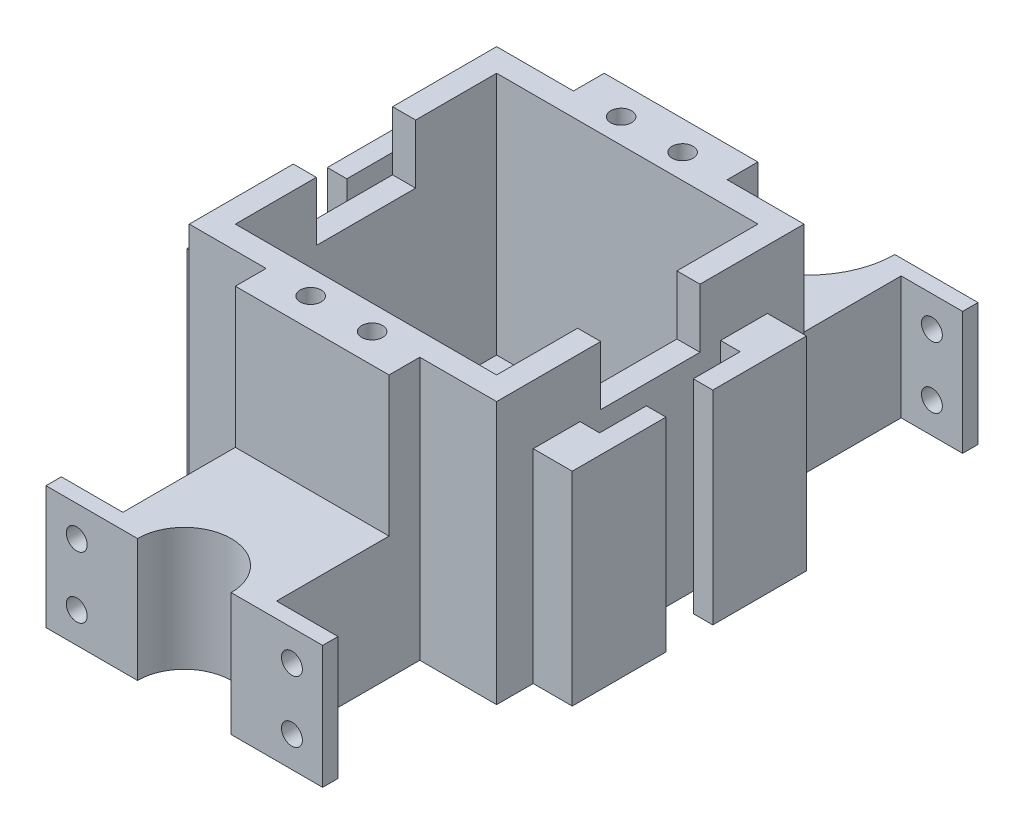
from build123d import *

# Parameters (mm, degrees)
SKETCH1_W                                    = 50
SKETCH1_H                                    = 50
BOSS_EXTRUDE1_DEPTH                          = 3
SKETCH3_W                                    = 50
SKETCH3_H                                    = 50
SKETCH3_W_2                                  = 42.5
SKETCH3_H_2                                  = 42.5
BOSS_EXTRUDE2_DEPTH                          = 39.7
SKETCH9_W                                    = 25
SKETCH9_H                                    = 20
BOSS_EXTRUDE4_DEPTH                          = 25.8
CUT_EXTRUDE1_REACH                           = 62.999
SKETCH11_R                                   = 7.62
SKETCH12_W                                   = 2.5
SKETCH12_H                                   = 20
BOSS_EXTRUDE5_DEPTH                          = 10
CUT_EXTRUDE2_REACH                           = 92.52
SKETCH13_R                                   = 1.7
SKETCH15_W                                   = 35
SKETCH15_H                                   = 20
BOSS_EXTRUDE6_DEPTH                          = 25.8
CUT_EXTRUDE3_REACH                           = 62.999
SKETCH16_R                                   = 13.97
SKETCH17_W                                   = 2.5
SKETCH17_H                                   = 20
BOSS_EXTRUDE7_DEPTH                          = 10
CUT_EXTRUDE4_REACH                           = 115.587
SKETCH18_R                                   = 1.7
CUT_EXTRUDE5_START                           = -5
SKETCH19_W                                   = 16.15
SKETCH19_H                                   = 9.6
CUT_EXTRUDE5_DEPTH                           = 90.617846817
SKETCH20_W                                   = 25
SKETCH20_H                                   = 5
BOSS_EXTRUDE8_DEPTH                          = 22.7
SKETCH21_R                                   = 1.7
CUT_EXTRUDE6_DEPTH                           = 10
SKETCH23_W                                   = 7.62
SKETCH23_H                                   = 33.09
BOSS_EXTRUDE9_DEPTH                          = 6.35
SKETCH24_W                                   = 3.175
SKETCH24_H                                   = 33.09
BOSS_EXTRUDE10_DEPTH                         = 7.62
SKETCH25_W                                   = 3.175
SKETCH25_H                                   = 33.09
BOSS_EXTRUDE11_DEPTH                         = 7.62
CUT_EXTRUDE8_REACH                           = 75.394
SKETCH27_R                                   = 11.5
CSK_FOR_M3_COUNTERSUNK_FLAT_HEAD_SCR_2_COUNT = 2
CSK_FOR_M3_COUNTERSUNK_FLAT_HEAD_SCR_2_PITCH = 31
CSK_FOR_M3_COUNTERSUNK_FLAT_HEAD_SCR_3_COUNT = 2
CSK_FOR_M3_COUNTERSUNK_FLAT_HEAD_SCR_3_PITCH = 43.840620434
CSK_FOR_M3_COUNTERSUNK_FLAT_HEAD_SCR_4_COUNT = 2
CSK_FOR_M3_COUNTERSUNK_FLAT_HEAD_SCR_4_PITCH = 31


with BuildPart() as part:
    # Sketch1 → Boss-Extrude1 (new body)
    with BuildSketch(Plane(origin=(0, 0, 0), x_dir=(1, 0, 0), z_dir=(0, 1, 0))):
        Rectangle(SKETCH1_W, SKETCH1_H)
    extrude(amount=BOSS_EXTRUDE1_DEPTH)

    # Sketch3 → Boss-Extrude2 (add)
    with BuildSketch(Plane(origin=(0, 3, 0), x_dir=(1, 0, 0), z_dir=(0, 1, 0))):
        Rectangle(SKETCH3_W, SKETCH3_H)
        Rectangle(SKETCH3_W_2, SKETCH3_H_2, mode=Mode.SUBTRACT)
    extrude(amount=BOSS_EXTRUDE2_DEPTH)

    # Sketch9 → Boss-Extrude4 (add)
    with BuildSketch(Plane.XY.offset(25)):
        with Locations((0, 10)):
            Rectangle(SKETCH9_W, SKETCH9_H)
    extrude(amount=BOSS_EXTRUDE4_DEPTH)

    # Sketch11 → Cut-Extrude1 (cut, up to next)
    with BuildSketch(Plane(origin=(0, 20, 0), x_dir=(1, 0, 0), z_dir=(0, 1, 0)), mode=Mode.PRIVATE) as cut_extrude1_sk1:
        with Locations((0, -50.8)):
            Circle(SKETCH11_R)
    cut_extrude1_tool1 = extrude(cut_extrude1_sk1.sketch, amount=-CUT_EXTRUDE1_REACH, mode=Mode.PRIVATE) & part.part
    add(cut_extrude1_tool1.solids().sort_by_distance((0, 20, 50.8))[0], mode=Mode.SUBTRACT)

    # Sketch12 → Boss-Extrude5 (add)
    with BuildSketch(Plane.ZY.offset(12.5)):
        with Locations((49.55, 10)):
            Rectangle(SKETCH12_W, SKETCH12_H)
    boss_extrude5 = extrude(amount=BOSS_EXTRUDE5_DEPTH)

    # Mirror2: Boss-Extrude5 across plane
    add(boss_extrude5.mirror(Plane(origin=(0, 0, 0), x_dir=(0, 0, 1), z_dir=(1, 0, 0))))

    # Sketch13 → Cut-Extrude2 (cut, up to next)
    with BuildSketch(Plane.XY.offset(50.8), mode=Mode.PRIVATE) as cut_extrude2_sk1:
        with Locations((-17.5, 5)):
            Circle(SKETCH13_R)
    cut_extrude2_tool1 = extrude(cut_extrude2_sk1.sketch, amount=-CUT_EXTRUDE2_REACH, mode=Mode.PRIVATE) & part.part
    # Sketch13 → Cut-Extrude2 (cut, up to next)
    with BuildSketch(Plane.XY.offset(50.8), mode=Mode.PRIVATE) as cut_extrude2_sk2:
        with Locations((17.5, 5)):
            Circle(SKETCH13_R)
    cut_extrude2_tool2 = extrude(cut_extrude2_sk2.sketch, amount=-CUT_EXTRUDE2_REACH, mode=Mode.PRIVATE) & part.part
    # Sketch13 → Cut-Extrude2 (cut, up to next)
    with BuildSketch(Plane.XY.offset(50.8), mode=Mode.PRIVATE) as cut_extrude2_sk3:
        with Locations((-17.5, 15)):
            Circle(SKETCH13_R)
    cut_extrude2_tool3 = extrude(cut_extrude2_sk3.sketch, amount=-CUT_EXTRUDE2_REACH, mode=Mode.PRIVATE) & part.part
    # Sketch13 → Cut-Extrude2 (cut, up to next)
    with BuildSketch(Plane.XY.offset(50.8), mode=Mode.PRIVATE) as cut_extrude2_sk4:
        with Locations((17.5, 15)):
            Circle(SKETCH13_R)
    cut_extrude2_tool4 = extrude(cut_extrude2_sk4.sketch, amount=-CUT_EXTRUDE2_REACH, mode=Mode.PRIVATE) & part.part
    add(cut_extrude2_tool1.solids().sort_by_distance((-17.5, 5, 50.8))[0], mode=Mode.SUBTRACT)
    add(cut_extrude2_tool2.solids().sort_by_distance((17.5, 5, 50.8))[0], mode=Mode.SUBTRACT)
    add(cut_extrude2_tool3.solids().sort_by_distance((-17.5, 15, 50.8))[0], mode=Mode.SUBTRACT)
    add(cut_extrude2_tool4.solids().sort_by_distance((17.5, 15, 50.8))[0], mode=Mode.SUBTRACT)

    # Sketch15 → Boss-Extrude6 (add)
    with BuildSketch(Plane(origin=(0, 0, -25), x_dir=(-1, 0, 0), z_dir=(0, 0, -1))):
        with Locations((0, 10)):
            Rectangle(SKETCH15_W, SKETCH15_H)
    extrude(amount=BOSS_EXTRUDE6_DEPTH)

    # Sketch16 → Cut-Extrude3 (cut, up to next)
    with BuildSketch(Plane(origin=(0, 20, 0), x_dir=(1, 0, 0), z_dir=(0, 1, 0)), mode=Mode.PRIVATE) as cut_extrude3_sk1:
        with Locations((0, 50.8)):
            Circle(SKETCH16_R)
    cut_extrude3_tool1 = extrude(cut_extrude3_sk1.sketch, amount=-CUT_EXTRUDE3_REACH, mode=Mode.PRIVATE) & part.part
    add(cut_extrude3_tool1.solids().sort_by_distance((0, 20, -50.8))[0], mode=Mode.SUBTRACT)

    # Sketch17 → Boss-Extrude7 (add)
    with BuildSketch(Plane.ZY.offset(17.5)):
        with Locations((-49.55, 10)):
            Rectangle(SKETCH17_W, SKETCH17_H)
    boss_extrude7 = extrude(amount=BOSS_EXTRUDE7_DEPTH)

    # Mirror3: Boss-Extrude7 across plane
    add(boss_extrude7.mirror(Plane(origin=(0, 0, 0), x_dir=(0, 0, 1), z_dir=(1, 0, 0))))

    # Sketch18 → Cut-Extrude4 (cut, up to next)
    with BuildSketch(Plane(origin=(0, 0, -50.8), x_dir=(-1, 0, 0), z_dir=(0, 0, -1)), mode=Mode.PRIVATE) as cut_extrude4_sk1:
        with Locations((-22.5, 15)):
            Circle(SKETCH18_R)
    cut_extrude4_tool1 = extrude(cut_extrude4_sk1.sketch, amount=-CUT_EXTRUDE4_REACH, mode=Mode.PRIVATE) & part.part
    # Sketch18 → Cut-Extrude4 (cut, up to next)
    with BuildSketch(Plane(origin=(0, 0, -50.8), x_dir=(-1, 0, 0), z_dir=(0, 0, -1)), mode=Mode.PRIVATE) as cut_extrude4_sk2:
        with Locations((-22.5, 5)):
            Circle(SKETCH18_R)
    cut_extrude4_tool2 = extrude(cut_extrude4_sk2.sketch, amount=-CUT_EXTRUDE4_REACH, mode=Mode.PRIVATE) & part.part
    # Sketch18 → Cut-Extrude4 (cut, up to next)
    with BuildSketch(Plane(origin=(0, 0, -50.8), x_dir=(-1, 0, 0), z_dir=(0, 0, -1)), mode=Mode.PRIVATE) as cut_extrude4_sk3:
        with Locations((22.5, 15)):
            Circle(SKETCH18_R)
    cut_extrude4_tool3 = extrude(cut_extrude4_sk3.sketch, amount=-CUT_EXTRUDE4_REACH, mode=Mode.PRIVATE) & part.part
    # Sketch18 → Cut-Extrude4 (cut, up to next)
    with BuildSketch(Plane(origin=(0, 0, -50.8), x_dir=(-1, 0, 0), z_dir=(0, 0, -1)), mode=Mode.PRIVATE) as cut_extrude4_sk4:
        with Locations((22.5, 5)):
            Circle(SKETCH18_R)
    cut_extrude4_tool4 = extrude(cut_extrude4_sk4.sketch, amount=-CUT_EXTRUDE4_REACH, mode=Mode.PRIVATE) & part.part
    add(cut_extrude4_tool1.solids().sort_by_distance((22.5, 15, -50.8))[0], mode=Mode.SUBTRACT)
    add(cut_extrude4_tool2.solids().sort_by_distance((22.5, 5, -50.8))[0], mode=Mode.SUBTRACT)
    add(cut_extrude4_tool3.solids().sort_by_distance((-22.5, 15, -50.8))[0], mode=Mode.SUBTRACT)
    add(cut_extrude4_tool4.solids().sort_by_distance((-22.5, 5, -50.8))[0], mode=Mode.SUBTRACT)

    # Sketch19 → Cut-Extrude5 (cut)
    with BuildSketch(Plane(origin=(25, 0, 0), x_dir=(0, 0, -1), z_dir=(1, 0, 0)).offset(CUT_EXTRUDE5_START)):
        with Locations((0, 37.9)):
            Rectangle(SKETCH19_W, SKETCH19_H)
    cut_extrude5 = extrude(amount=CUT_EXTRUDE5_DEPTH, mode=Mode.SUBTRACT)

    # Sketch20 → Boss-Extrude8 (add)
    with BuildSketch(Plane(origin=(0, 20, 0), x_dir=(1, 0, 0), z_dir=(0, 1, 0))):
        with Locations((0, -27.5)):
            Rectangle(SKETCH20_W, SKETCH20_H)
        with Locations((0, 27.5)):
            Rectangle(SKETCH20_W, SKETCH20_H)
    extrude(amount=BOSS_EXTRUDE8_DEPTH)

    # Sketch21 → Cut-Extrude6 (cut)
    with BuildSketch(Plane(origin=(0, 42.7, 0), x_dir=(1, 0, 0), z_dir=(0, 1, 0))):
        with Locations(Location((5, -25.25, 0), (0, 0, 270))):
            Circle(SKETCH21_R)
        with Locations(Location((-5, 25.25, 0), (0, 0, 270))):
            Circle(SKETCH21_R)
        with Locations(Location((5, 25.25, 0), (0, 0, 270))):
            Circle(SKETCH21_R)
        with Locations(Location((-5, -25.25, 0), (0, 0, 270))):
            Circle(SKETCH21_R)
    extrude(amount=-CUT_EXTRUDE6_DEPTH, mode=Mode.SUBTRACT)

    # Sketch23 → Boss-Extrude9 (add)
    with BuildSketch(Plane.ZY.offset(25)):
        with Locations((-15.24, 16.545)):
            Rectangle(SKETCH23_W, SKETCH23_H)
        with Locations((15.24, 16.545)):
            Rectangle(SKETCH23_W, SKETCH23_H)
    boss_extrude9 = extrude(amount=BOSS_EXTRUDE9_DEPTH)

    # Sketch24 → Boss-Extrude10 (add)
    with BuildSketch(Plane.XY.offset(-11.43)):
        with Locations((-29.7625, 16.545)):
            Rectangle(SKETCH24_W, SKETCH24_H)
    boss_extrude10 = extrude(amount=BOSS_EXTRUDE10_DEPTH)

    # Sketch25 → Boss-Extrude11 (add)
    with BuildSketch(Plane(origin=(0, 0, 11.43), x_dir=(-1, 0, 0), z_dir=(0, 0, -1))):
        with Locations((29.7625, 16.545)):
            Rectangle(SKETCH25_W, SKETCH25_H)
    boss_extrude11 = extrude(amount=BOSS_EXTRUDE11_DEPTH)

    # Sketch27 → Cut-Extrude8 (cut, up to next)
    with BuildSketch(Plane.XZ, mode=Mode.PRIVATE) as cut_extrude8_sk1:
        with Locations(Location((0, 0, 0), (0, 0, 270))):
            Circle(SKETCH27_R)
    cut_extrude8_tool1 = extrude(cut_extrude8_sk1.sketch, amount=-CUT_EXTRUDE8_REACH, mode=Mode.PRIVATE) & part.part
    add(cut_extrude8_tool1.solids().sort_by_distance((0, 0, 0))[0], mode=Mode.SUBTRACT)

    # Sketch30 → CSK for M3 Countersunk Flat Head Screw1 (revolve, cut)
    with BuildSketch(Plane(origin=(-15.5, 0, 15.5), x_dir=(0, 0, -1), z_dir=(1, 0, 0))):
        Polygon((0, 0), (0, 3), (1.7, 3), (1.7, 1.45), (3.15, 0), align=None)
    csk_for_m3_countersunk_flat_head_screw1 = revolve(axis=Axis((-15.5, -6.35, 15.5), (0, 1, 0)), mode=Mode.SUBTRACT)

    # CSK for M3 Countersunk Flat Head Scr 2: CSK for M3 Countersunk Flat Head Screw1 ×2
    with Locations(*[(i * CSK_FOR_M3_COUNTERSUNK_FLAT_HEAD_SCR_2_PITCH, 0, 0) for i in range(1, CSK_FOR_M3_COUNTERSUNK_FLAT_HEAD_SCR_2_COUNT)]):
        add(csk_for_m3_countersunk_flat_head_screw1, mode=Mode.SUBTRACT)

    # CSK for M3 Countersunk Flat Head Scr 3: CSK for M3 Countersunk Flat Head Screw1 ×2
    with Locations(*[Vector(0.7071067811865475, 0, -0.7071067811865476) * (i * CSK_FOR_M3_COUNTERSUNK_FLAT_HEAD_SCR_3_PITCH) for i in range(1, CSK_FOR_M3_COUNTERSUNK_FLAT_HEAD_SCR_3_COUNT)]):
        add(csk_for_m3_countersunk_flat_head_screw1, mode=Mode.SUBTRACT)

    # CSK for M3 Countersunk Flat Head Scr 4: CSK for M3 Countersunk Flat Head Screw1 ×2
    with Locations(*[(0, 0, -i * CSK_FOR_M3_COUNTERSUNK_FLAT_HEAD_SCR_4_PITCH) for i in range(1, CSK_FOR_M3_COUNTERSUNK_FLAT_HEAD_SCR_4_COUNT)]):
        add(csk_for_m3_countersunk_flat_head_screw1, mode=Mode.SUBTRACT)

    # Mirror4: Cut-Extrude5, Boss-Extrude9, Boss-Extrude10, Boss-Extrude11 across plane
    add(cut_extrude5.mirror(Plane(origin=(0, 0, 0), x_dir=(0, 0, 1), z_dir=(1, 0, 0))), mode=Mode.SUBTRACT)
    add(boss_extrude9.mirror(Plane(origin=(0, 0, 0), x_dir=(0, 0, 1), z_dir=(1, 0, 0))))
    add(boss_extrude10.mirror(Plane(origin=(0, 0, 0), x_dir=(0, 0, 1), z_dir=(1, 0, 0))))
    add(boss_extrude11.mirror(Plane(origin=(0, 0, 0), x_dir=(0, 0, 1), z_dir=(1, 0, 0))))


solid = part.part
